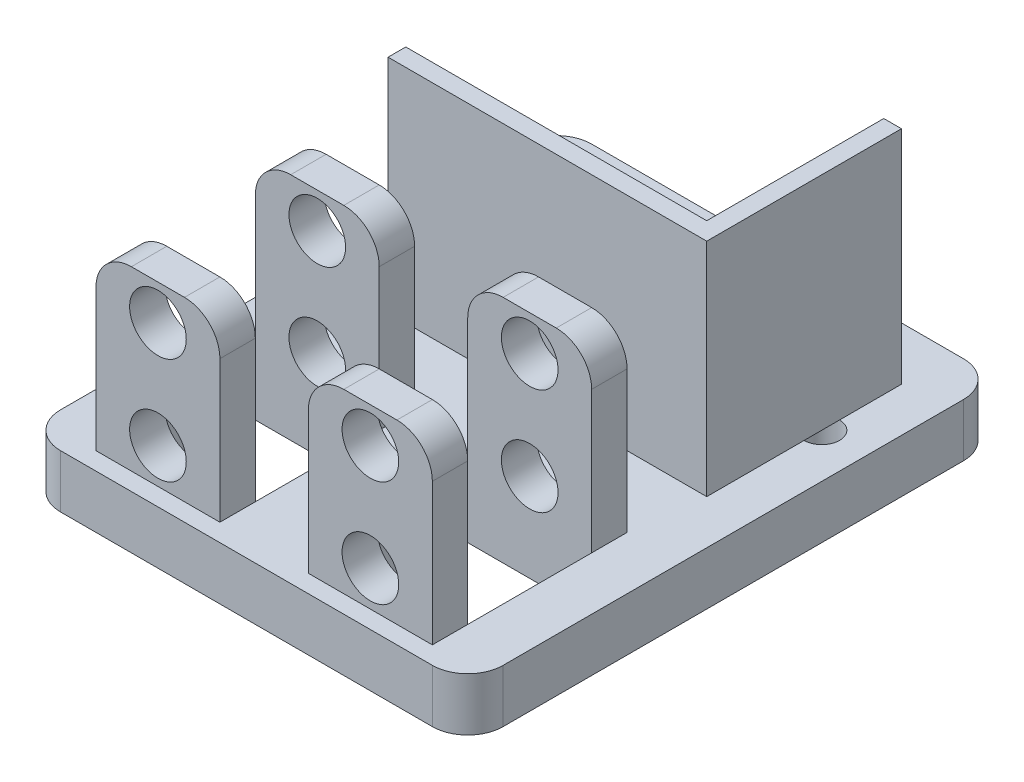
from build123d import *

# Parameters (mm, degrees)
SKETCH_1_R               = 1
SKETCH_1_W               = 16
SKETCH_1_H               = 9
SKETCH_1_W_2             = 7
SKETCH_1_H_2             = 7
EXTRUDE_1_DEPTH          = 3
SKETCH_2_W               = 7
SKETCH_2_H               = 2
EXTRUDE_2_DEPTH          = 10
CUT_EXTRUDE_1_DEPTH      = 35.150402633
CUT_EXTRUDE_1_DEPTH_BACK = 35.150402633
SKETCH_3_R               = 1.6
FILLET_1_R               = 2
SKETCH_4_W               = 1.2
SKETCH_4_H               = 3.5
CUT_EXTRUDE_3_DEPTH      = 10
EXTRUDE_3_DEPTH          = 7.5
EXTRUDE_6_DEPTH          = 5


with BuildPart() as part:
    # 草图1 → 凸台-拉伸1 (new body)
    with BuildSketch(Plane(origin=(0, 0, 0), x_dir=(1, 0, 0), z_dir=(0, 1, 0))):
        with BuildLine():
            Line((-10.5, -15), (10.5, -15))
            ThreePointArc((10.5, -15), (11.914213562, -14.414213562), (12.5, -13))
            Line((12.5, -13), (12.5, 13))
            ThreePointArc((12.5, 13), (11.914213562, 14.414213562), (10.5, 15))
            Line((10.5, 15), (-10.5, 15))
            ThreePointArc((-10.5, 15), (-11.914213562, 14.414213562), (-12.5, 13))
            Line((-12.5, 13), (-12.5, -13))
            ThreePointArc((-12.5, -13), (-11.914213562, -14.414213562), (-10.5, -15))
        make_face()
        with Locations(Location((-10, 7.5, 0), (0, 0, 270))):
            Circle(SKETCH_1_R, mode=Mode.SUBTRACT)
        with Locations(Location((10, 7.5, 0), (0, 0, 90))):
            Circle(SKETCH_1_R, mode=Mode.SUBTRACT)
        with Locations((0, 7.5)):
            Rectangle(SKETCH_1_W, SKETCH_1_H, mode=Mode.SUBTRACT)
        with Locations((6, -8.5)):
            Rectangle(SKETCH_1_W_2, SKETCH_1_H_2, mode=Mode.SUBTRACT)
        with Locations((-6, -8.5)):
            Rectangle(SKETCH_1_W_2, SKETCH_1_H_2, mode=Mode.SUBTRACT)
    extrude(amount=EXTRUDE_1_DEPTH)

    # 草图2 → 凸台-拉伸2 (add)
    with BuildSketch(Plane(origin=(0, 3, 0), x_dir=(1, 0, 0), z_dir=(0, 1, 0))):
        with Locations((-6, -4)):
            Rectangle(SKETCH_2_W, SKETCH_2_H)
        with Locations((-6, -13)):
            Rectangle(SKETCH_2_W, SKETCH_2_H)
        with Locations((6, -4)):
            Rectangle(SKETCH_2_W, SKETCH_2_H)
        with Locations((6, -13)):
            Rectangle(SKETCH_2_W, SKETCH_2_H)
    extrude(amount=EXTRUDE_2_DEPTH)

    # 草图3 → 切除-拉伸1 (cut, two sides: drawn at the far end of the back side and taken through both)
    with BuildSketch(Plane.XY.offset(14).offset(-CUT_EXTRUDE_1_DEPTH_BACK)):
        with Locations((-6, 11)):
            Circle(SKETCH_3_R)
        with Locations((-6, 5)):
            Circle(SKETCH_3_R)
        with Locations((6, 11)):
            Circle(SKETCH_3_R)
        with Locations((6, 5)):
            Circle(SKETCH_3_R)
    extrude(amount=CUT_EXTRUDE_1_DEPTH + CUT_EXTRUDE_1_DEPTH_BACK, mode=Mode.SUBTRACT)

    # 圆角1
    fillet_1_edges = [part.edges().sort_by_distance(p)[0] for p in [
        (2.5, 13, 4),
        (9.5, 13, 4),
        (2.5, 13, 13),
        (9.5, 13, 13),
        (-9.5, 13, 4),
        (-2.5, 13, 4),
        (-9.5, 13, 13),
        (-2.5, 13, 13),
    ]]
    fillet(fillet_1_edges, radius=FILLET_1_R)

    # 草图4 → 切除-拉伸3 (cut)
    with BuildSketch(Plane.XZ):
        with Locations((-8.6, -7.5)):
            Rectangle(SKETCH_4_W, SKETCH_4_H)
    extrude(amount=-CUT_EXTRUDE_3_DEPTH, mode=Mode.SUBTRACT)

    # 草图5 → 凸台-拉伸3 (add)
    with BuildSketch(Plane(origin=(0, 3, 0), x_dir=(1, 0, 0), z_dir=(0, 1, 0))):
        Polygon((-8, 3), (-8, 1), (10, 1), (10, 12), (8, 12), (8, 3), align=None)
    extrude(amount=EXTRUDE_3_DEPTH)

    # 草图8 → 凸台-拉伸6 (add)
    with BuildSketch(Plane(origin=(0, 10.5, 0), x_dir=(1, 0, 0), z_dir=(0, 1, 0))):
        Polygon((-8, 1), (-8, 2), (9, 2), (9, 12), (10, 12), (10, 1), align=None)
    extrude(amount=EXTRUDE_6_DEPTH)


solid = part.part
